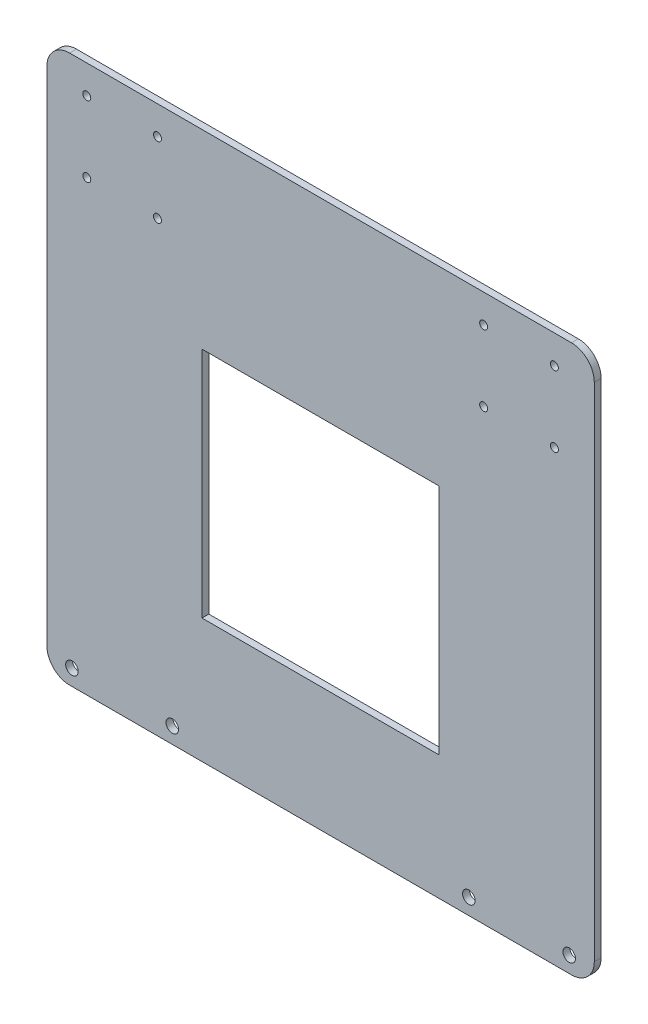
from build123d import *

# Parameters (mm, degrees)
SKETCH3_R           = 1.75
SKETCH3_R_2         = 2.75
BOSS_EXTRUDE1_DEPTH = 3
SKETCH4_W           = 104
SKETCH4_H           = 102.1
CUT_EXTRUDE1_DEPTH  = 3


with BuildPart() as part:
    # Sketch3 → Boss-Extrude1 (new body)
    with BuildSketch(Plane.XY):
        with BuildLine():
            Line((118.968983292, -110.515508354), (118.968983292, 109.484491646))
            ThreePointArc((118.968983292, 109.484491646), (116.040051104, 116.555559458), (108.968983292, 119.484491646))
            Line((108.968983292, 119.484491646), (-111.031016708, 119.484491646))
            ThreePointArc((-111.031016708, 119.484491646), (-118.10208452, 116.555559458), (-121.031016708, 109.484491646))
            Line((-121.031016708, 109.484491646), (-121.031016708, -110.515508354))
            ThreePointArc((-121.031016708, -110.515508354), (-118.10208452, -117.586576166), (-111.031016708, -120.515508354))
            Line((-111.031016708, -120.515508354), (108.968983292, -120.515508354))
            ThreePointArc((108.968983292, -120.515508354), (116.040051104, -117.586576166), (118.968983292, -110.515508354))
        make_face()
        with Locations((-103.531016708, 75.984491646)):
            Circle(SKETCH3_R, mode=Mode.SUBTRACT)
        with Locations((-103.531016708, 106.984491646)):
            Circle(SKETCH3_R, mode=Mode.SUBTRACT)
        with Locations((-72.531016708, 106.984491646)):
            Circle(SKETCH3_R, mode=Mode.SUBTRACT)
        with Locations((-72.531016708, 75.984491646)):
            Circle(SKETCH3_R, mode=Mode.SUBTRACT)
        with Locations((-110.031016708, -113.515508354)):
            Circle(SKETCH3_R_2, mode=Mode.SUBTRACT)
        with Locations((-66.031016708, -113.515508354)):
            Circle(SKETCH3_R_2, mode=Mode.SUBTRACT)
        with Locations((63.968983292, -113.515508354)):
            Circle(SKETCH3_R_2, mode=Mode.SUBTRACT)
        with Locations((101.468983292, 75.984491646)):
            Circle(SKETCH3_R, mode=Mode.SUBTRACT)
        with Locations((101.468983292, 106.984491646)):
            Circle(SKETCH3_R, mode=Mode.SUBTRACT)
        with Locations((70.468983292, 106.984491646)):
            Circle(SKETCH3_R, mode=Mode.SUBTRACT)
        with Locations((70.468983292, 75.984491646)):
            Circle(SKETCH3_R, mode=Mode.SUBTRACT)
        with Locations((107.968983292, -113.515508354)):
            Circle(SKETCH3_R_2, mode=Mode.SUBTRACT)
    extrude(amount=BOSS_EXTRUDE1_DEPTH)

    # Sketch4 → Cut-Extrude1 (cut)
    with BuildSketch(Plane.XY.offset(3)):
        with Locations((-1.031016708, -14.965508354)):
            Rectangle(SKETCH4_W, SKETCH4_H)
    extrude(amount=-CUT_EXTRUDE1_DEPTH, mode=Mode.SUBTRACT)


solid = part.part
